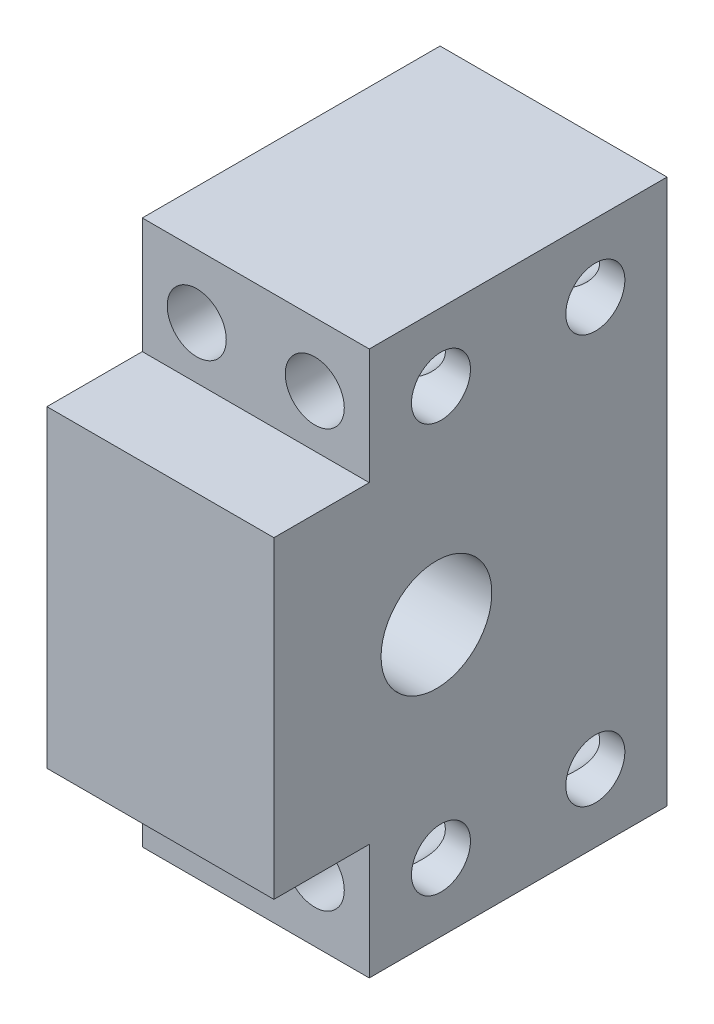
from build123d import *

# Parameters (mm, degrees)
SKETCH1_W           = 25
SKETCH1_H           = 34.5
SKETCH1_H_2         = 12.75
SKETCH1_R           = 3.25
BOSS_EXTRUDE1_DEPTH = 32.8
BOSS_EXTRUDE2_START = 32.8
SKETCH1_3_W         = 25
SKETCH1_3_H         = 34.5
BOSS_EXTRUDE2_DEPTH = 10.5
CUT_EXTRUDE1_REACH  = 342.376
SKETCH2_R           = 3.25
SKETCH2_R_2         = 6.1


with BuildPart() as part:
    # Sketch1 → Boss-Extrude1 (new body)
    # profile 1 of 3: a face of its own
    with BuildSketch(Plane.XY):
        with Locations((323.774999942, 0)):
            Rectangle(SKETCH1_W, SKETCH1_H)
    # profile 2 of 3: a face of its own
    with BuildSketch(Plane.XY):
        with Locations((323.774999942, 23.625)):
            Rectangle(SKETCH1_W, SKETCH1_H_2)
        with Locations((317.274999942, 23)):
            Circle(SKETCH1_R, mode=Mode.SUBTRACT)
        with Locations((330.274999942, 23)):
            Circle(SKETCH1_R, mode=Mode.SUBTRACT)
    # profile 3 of 3: a face of its own
    with BuildSketch(Plane.XY):
        with Locations((323.774999942, -23.625)):
            Rectangle(SKETCH1_W, SKETCH1_H_2)
        with Locations((317.274999942, -23)):
            Circle(SKETCH1_R, mode=Mode.SUBTRACT)
        with Locations((330.274999942, -23)):
            Circle(SKETCH1_R, mode=Mode.SUBTRACT)
    extrude(amount=BOSS_EXTRUDE1_DEPTH)

    # Sketch1<3> → Boss-Extrude2 (add)
    with BuildSketch(Plane.XY.offset(BOSS_EXTRUDE2_START)):
        with Locations((323.774999942, 0)):
            Rectangle(SKETCH1_3_W, SKETCH1_3_H)
    extrude(amount=BOSS_EXTRUDE2_DEPTH)

    # Sketch2 → Cut-Extrude1 (cut, up to next)
    with BuildSketch(Plane(origin=(0, 0, 0), x_dir=(0, 0, -1), z_dir=(1, 0, 0)), mode=Mode.PRIVATE) as cut_extrude1_sk1:
        with Locations(Location((-24.9, 22.5, 0), (0, 0, 180))):
            Circle(SKETCH2_R)
    cut_extrude1_tool1 = extrude(cut_extrude1_sk1.sketch, amount=CUT_EXTRUDE1_REACH, mode=Mode.PRIVATE) & part.part
    # Sketch2 → Cut-Extrude1 (cut, up to next)
    with BuildSketch(Plane(origin=(0, 0, 0), x_dir=(0, 0, -1), z_dir=(1, 0, 0)), mode=Mode.PRIVATE) as cut_extrude1_sk2:
        with Locations(Location((-7.9, 22.5, 0), (0, 0, 180))):
            Circle(SKETCH2_R)
    cut_extrude1_tool2 = extrude(cut_extrude1_sk2.sketch, amount=CUT_EXTRUDE1_REACH, mode=Mode.PRIVATE) & part.part
    # Sketch2 → Cut-Extrude1 (cut, up to next)
    with BuildSketch(Plane(origin=(0, 0, 0), x_dir=(0, 0, -1), z_dir=(1, 0, 0)), mode=Mode.PRIVATE) as cut_extrude1_sk3:
        with Locations(Location((-7.9, -22.5, 0), (0, 0, 180))):
            Circle(SKETCH2_R)
    cut_extrude1_tool3 = extrude(cut_extrude1_sk3.sketch, amount=CUT_EXTRUDE1_REACH, mode=Mode.PRIVATE) & part.part
    # Sketch2 → Cut-Extrude1 (cut, up to next)
    with BuildSketch(Plane(origin=(0, 0, 0), x_dir=(0, 0, -1), z_dir=(1, 0, 0)), mode=Mode.PRIVATE) as cut_extrude1_sk4:
        with Locations(Location((-24.9, -22.5, 0), (0, 0, 180))):
            Circle(SKETCH2_R)
    cut_extrude1_tool4 = extrude(cut_extrude1_sk4.sketch, amount=CUT_EXTRUDE1_REACH, mode=Mode.PRIVATE) & part.part
    # Sketch2 → Cut-Extrude1 (cut, up to next)
    with BuildSketch(Plane(origin=(0, 0, 0), x_dir=(0, 0, -1), z_dir=(1, 0, 0)), mode=Mode.PRIVATE) as cut_extrude1_sk5:
        with Locations(Location((-25.4, 0, 0), (0, 0, 180))):
            Circle(SKETCH2_R_2)
    cut_extrude1_tool5 = extrude(cut_extrude1_sk5.sketch, amount=CUT_EXTRUDE1_REACH, mode=Mode.PRIVATE) & part.part
    add(cut_extrude1_tool1.solids().sort_by_distance((0, 22.5, 24.9))[0], mode=Mode.SUBTRACT)
    add(cut_extrude1_tool2.solids().sort_by_distance((0, 22.5, 7.9))[0], mode=Mode.SUBTRACT)
    add(cut_extrude1_tool3.solids().sort_by_distance((0, -22.5, 7.9))[0], mode=Mode.SUBTRACT)
    add(cut_extrude1_tool4.solids().sort_by_distance((0, -22.5, 24.9))[0], mode=Mode.SUBTRACT)
    add(cut_extrude1_tool5.solids().sort_by_distance((0, 0, 25.4))[0], mode=Mode.SUBTRACT)


solid = part.part
